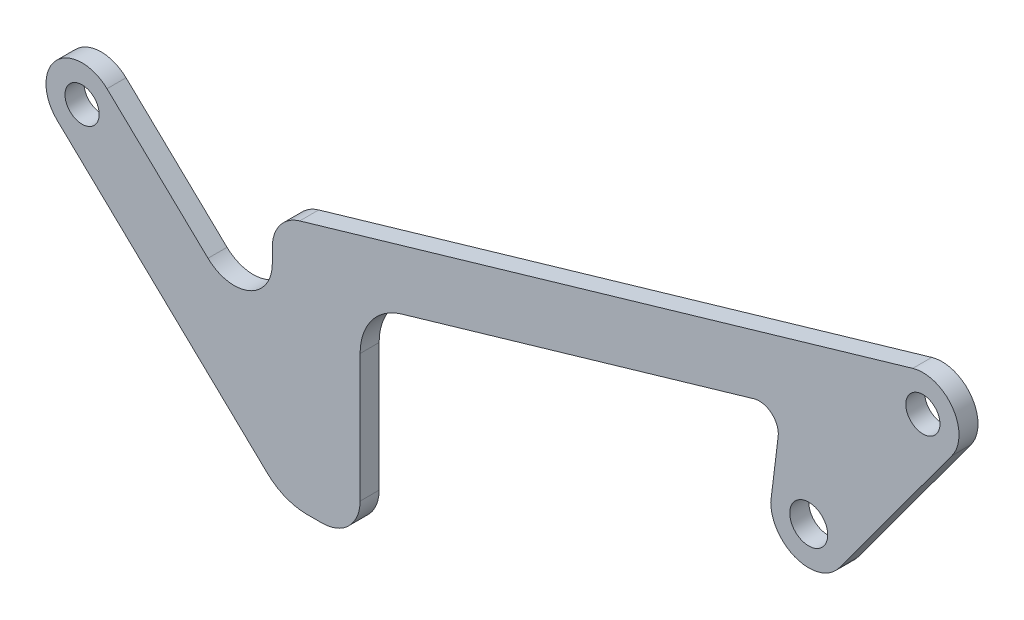
from build123d import *

# Parameters (mm, degrees)
SKETCH1_R           = 4.99
SKETCH1_R_2         = 4.49
BOSS_EXTRUDE1_DEPTH = 5


with BuildPart() as part:
    # Sketch1 → Boss-Extrude1 (new body)
    with BuildSketch(Plane.XY):
        with BuildLine():
            Line((-133.800547442, 2.100285816), (27.342280478, 49.110248457))
            ThreePointArc((27.342280478, 49.110248457), (37.775341878, 45.440970381), (37.648560391, 34.382204707))
            Line((37.648560391, 34.382204707), (8.05154039, -5.913780293))
            ThreePointArc((8.05154039, -5.913780293), (-3.111688569, -9.493023451), (-9.99, 0))
            Line((-9.99, 0), (-8.035082933, 15.898008925))
            ThreePointArc((-8.035082933, 15.898008925), (-9.75887393, 20.317439667), (-14.397978323, 21.308163599))
            Line((-14.397978323, 21.308163599), (-107.124555833, -5.742825892))
            ThreePointArc((-107.124555833, -5.742825892), (-114.923991281, -11.142928518), (-117.92373467, -20.142586361))
            Line((-117.92373467, -20.142586361), (-117.92373467, -53.749229456))
            ThreePointArc((-117.92373467, -53.749229456), (-120.852666858, -60.820297268), (-127.92373467, -63.749229456))
            Line((-127.92373467, -63.749229456), (-131.916457627, -63.749229456))
            ThreePointArc((-131.916457627, -63.749229456), (-137.493140936, -62.674049142), (-142.270365562, -59.602643226))
            Line((-142.270365562, -59.602643226), (-197.550572421, -6.866593112))
            ThreePointArc((-197.550572421, -6.866593112), (-197.866593112, 6.550572421), (-184.449427579, 6.866593112))
            Line((-184.449427579, 6.866593112), (-157.90260529, -18.4584668))
            ThreePointArc((-157.90260529, -18.4584668), (-147.064650772, -20.415954294), (-141, -11.22285762))
            Line((-141, -11.22285762), (-141, -7.499554497))
            ThreePointArc((-141, -7.499554497), (-139.000171074, -1.499782602), (-133.800547442, 2.100285816))
        make_face()
        Circle(SKETCH1_R, mode=Mode.SUBTRACT)
        with Locations((-191, 0)):
            Circle(SKETCH1_R_2, mode=Mode.SUBTRACT)
        with Locations((30, 40)):
            Circle(SKETCH1_R_2, mode=Mode.SUBTRACT)
    extrude(amount=BOSS_EXTRUDE1_DEPTH)


solid = part.part
